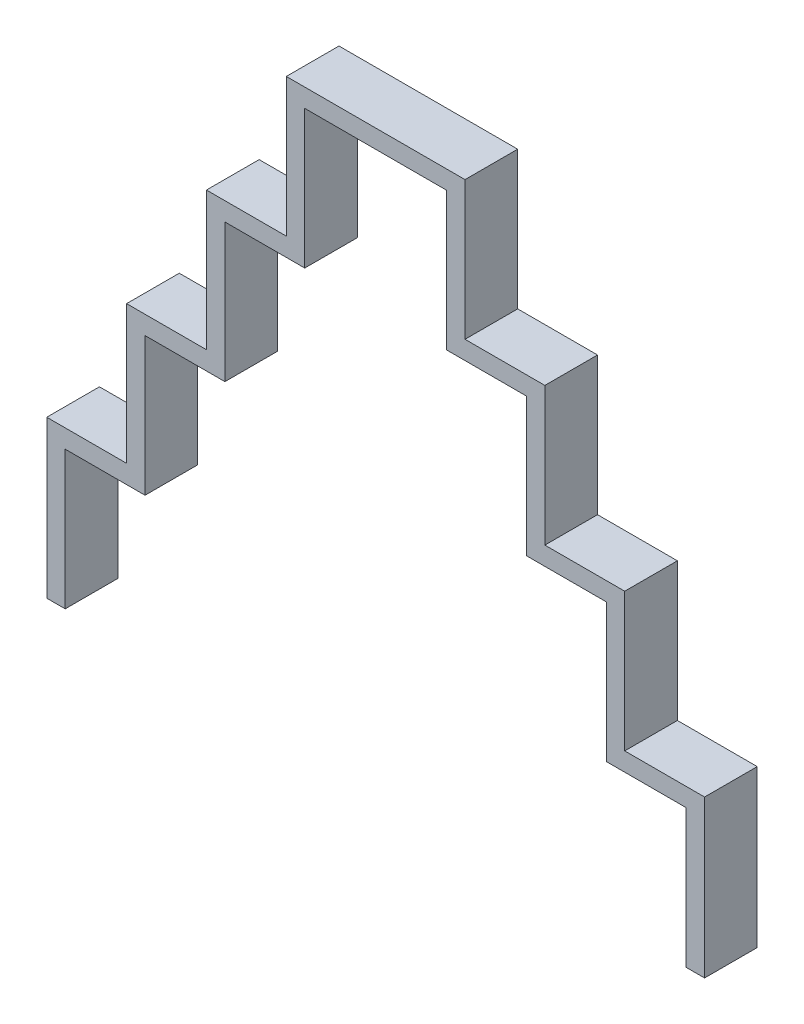
from build123d import *

# Parameters (mm, degrees)
EXTRUDE_1_DEPTH = 2


with BuildPart() as part:
    # 草图1 → 凸台-拉伸1 (new body)
    with BuildSketch(Plane.XY):
        Polygon((-2.69173326, 21), (2.69173326, 21), (2.69173326, 15.75), (5.722822174, 15.75), (5.722822174, 10.5), (8.753911087, 10.5), (8.753911087, 5.25), (11.785, 5.25), (11.785, 0), (12.485, 0), (12.485, 5.95), (9.453911087, 5.95), (9.453911087, 11.2), (6.422822174, 11.2), (6.422822174, 16.45), (3.39173326, 16.45), (3.39173326, 21.7), (-3.39173326, 21.7), (-3.39173326, 16.45), (-6.422822174, 16.45), (-6.422822174, 11.2), (-9.453911087, 11.2), (-9.453911087, 5.95), (-12.485, 5.95), (-12.485, 0), (-11.785, 0), (-11.785, 5.25), (-8.753911087, 5.25), (-8.753911087, 10.5), (-5.722822174, 10.5), (-5.722822174, 15.75), (-2.69173326, 15.75), align=None)
    extrude(amount=EXTRUDE_1_DEPTH)


solid = part.part
